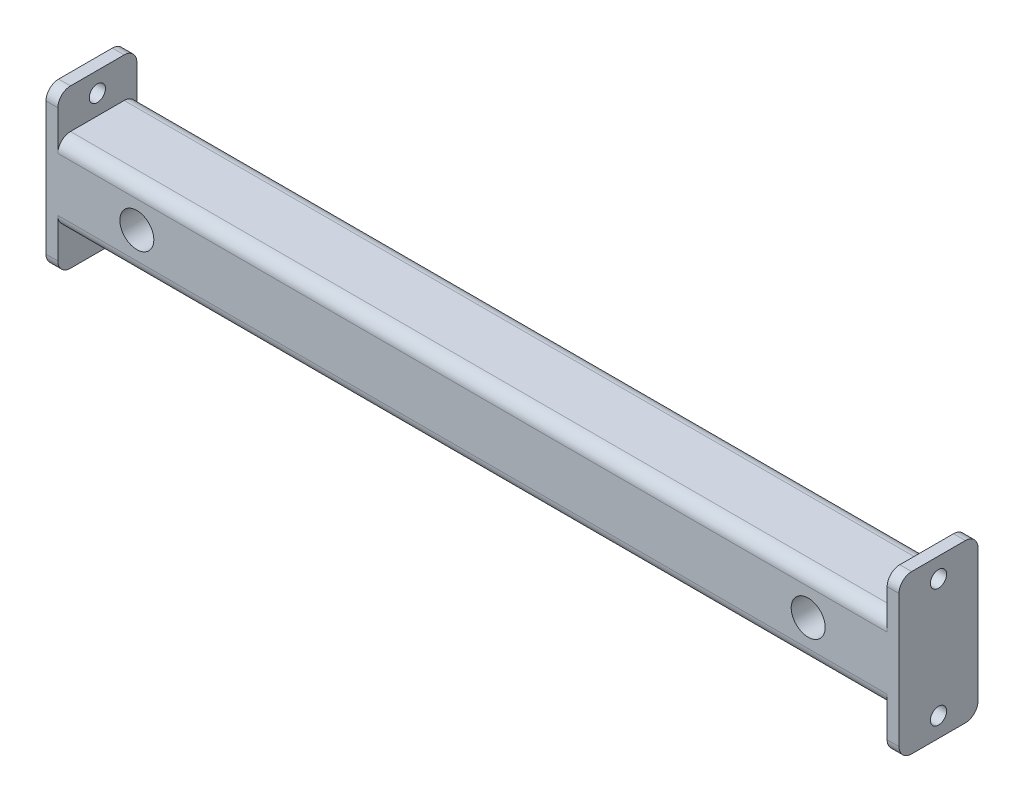
from build123d import *

# Parameters (mm, degrees)
DODANIE_WYCI_GNI_CIE2_DEPTH = 420
SZKIC4_R                    = 4.1
DODANIE_WYCI_GNI_CIE3_DEPTH = 6
SZKIC6_R                    = 8.6
WYTNIJ_WYCI_GNI_CIE1_DEPTH  = 430.73945595
DODANIE_WYCI_GNI_CIE5_REACH = 431.739
SZKIC6_3_R                  = 13.5
SZKIC6_3_R_2                = 8.6


with BuildPart() as part:
    # Szkic3 → Dodanie-wyciągnięcie2 (new body)
    with BuildSketch(Plane(origin=(0, 0, 0), x_dir=(0, 0, -1), z_dir=(1, 0, 0))):
        with BuildLine():
            Line((-13.6, -20), (13.6, -20))
            ThreePointArc((13.6, -20), (18.1254834, -18.1254834), (20, -13.6))
            Line((20, -13.6), (20, 13.6))
            ThreePointArc((20, 13.6), (18.1254834, 18.1254834), (13.6, 20))
            Line((13.6, 20), (-13.6, 20))
            ThreePointArc((-13.6, 20), (-18.1254834, 18.1254834), (-20, 13.6))
            Line((-20, 13.6), (-20, -13.6))
            ThreePointArc((-20, -13.6), (-18.1254834, -18.1254834), (-13.6, -20))
        make_face()
        with BuildLine():
            Line((-9.6, 16), (9.6, 16))
            ThreePointArc((9.6, 16), (14.1254834, 14.1254834), (16, 9.6))
            Line((16, 9.6), (16, -9.6))
            ThreePointArc((16, -9.6), (14.1254834, -14.1254834), (9.6, -16))
            Line((9.6, -16), (-9.6, -16))
            ThreePointArc((-9.6, -16), (-14.1254834, -14.1254834), (-16, -9.6))
            Line((-16, -9.6), (-16, 9.6))
            ThreePointArc((-16, 9.6), (-14.1254834, 14.1254834), (-9.6, 16))
        make_face(mode=Mode.SUBTRACT)
    extrude(amount=DODANIE_WYCI_GNI_CIE2_DEPTH)

    # Szkic4 → Dodanie-wyciągnięcie3 (add)
    with BuildSketch(Plane(origin=(420, 0, 0), x_dir=(0, 0, -1), z_dir=(1, 0, 0))):
        with BuildLine():
            Line((-13.6, -40), (13.6, -40))
            ThreePointArc((13.6, -40), (18.1254834, -38.1254834), (20, -33.6))
            Line((20, -33.6), (20, 33.6))
            ThreePointArc((20, 33.6), (18.1254834, 38.1254834), (13.6, 40))
            Line((13.6, 40), (-13.6, 40))
            ThreePointArc((-13.6, 40), (-18.1254834, 38.1254834), (-20, 33.6))
            Line((-20, 33.6), (-20, -33.6))
            ThreePointArc((-20, -33.6), (-18.1254834, -38.1254834), (-13.6, -40))
        make_face()
        with Locations((0, 30)):
            Circle(SZKIC4_R, mode=Mode.SUBTRACT)
        with Locations((0, -30)):
            Circle(SZKIC4_R, mode=Mode.SUBTRACT)
    dodanie_wyci_gni_cie3 = extrude(amount=DODANIE_WYCI_GNI_CIE3_DEPTH)

    # Lustro4: Dodanie-wyciągnięcie3 across plane
    add(dodanie_wyci_gni_cie3.mirror(Plane(origin=(210, 0, 0), x_dir=(0, 0, 1), z_dir=(1, 0, 0))))

    # Szkic6 → Wytnij-wyciągnięcie1 (cut, through all)
    with BuildSketch(Plane(origin=(0, 0, -20), x_dir=(-1, 0, 0), z_dir=(0, 0, -1))):
        with Locations((-40, 0)):
            Circle(SZKIC6_R)
    wytnij_wyci_gni_cie1 = extrude(amount=-WYTNIJ_WYCI_GNI_CIE1_DEPTH, mode=Mode.SUBTRACT)

    # Szkic6<3> → Dodanie-wyciągnięcie5 (add, up to next)
    with BuildSketch(Plane(origin=(0, 0, -20), x_dir=(-1, 0, 0), z_dir=(0, 0, -1)), mode=Mode.PRIVATE) as dodanie_wyci_gni_cie5_sk1:
        with Locations((-40, 0)):
            Circle(SZKIC6_3_R)
        with Locations((-40, 0)):
            Circle(SZKIC6_3_R_2, mode=Mode.SUBTRACT)
    dodanie_wyci_gni_cie5_tool1 = extrude(dodanie_wyci_gni_cie5_sk1.sketch, amount=-DODANIE_WYCI_GNI_CIE5_REACH, mode=Mode.PRIVATE) - part.part
    dodanie_wyci_gni_cie5 = dodanie_wyci_gni_cie5_tool1.solids().sort_by_distance((53.118162, 0, -20))[0]
    add(dodanie_wyci_gni_cie5)

    # Lustro6: Wytnij-wyciągnięcie1, Dodanie-wyciągnięcie5 across plane
    add(wytnij_wyci_gni_cie1.mirror(Plane(origin=(210, 0, 0), x_dir=(0, 0, 1), z_dir=(1, 0, 0))), mode=Mode.SUBTRACT)
    add(dodanie_wyci_gni_cie5.mirror(Plane(origin=(210, 0, 0), x_dir=(0, 0, 1), z_dir=(1, 0, 0))))


solid = part.part
